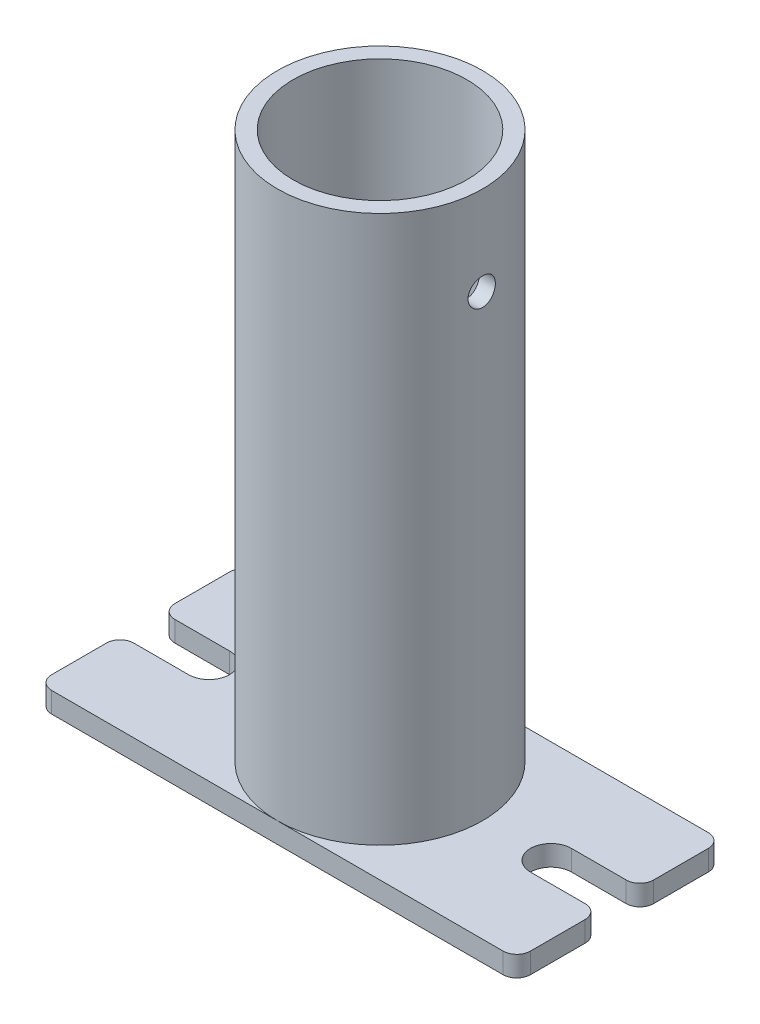
from build123d import *

# Parameters (mm, degrees)
BOSS_EXTRUDE2_DEPTH = 3
SKETCH3_R           = 15
BOSS_EXTRUDE3_DEPTH = 5
SKETCH4_R           = 15
SKETCH4_R_2         = 12.7
BOSS_EXTRUDE5_DEPTH = 75
SKETCH5_R           = 2
CUT_EXTRUDE1_DEPTH  = 40


with BuildPart() as part:
    # Sketch1 → Boss-Extrude2 (new body)
    with BuildSketch(Plane(origin=(0, 0, 0), x_dir=(1, 0, 0), z_dir=(0, 1, 0))):
        with BuildLine():
            Line((2, 0), (68, 0))
            ThreePointArc((68, 0), (69.414213562, 0.585786438), (70, 2))
            Line((70, 2), (70, 10))
            ThreePointArc((70, 10), (69.414213562, 11.414213562), (68, 12))
            Line((68, 12), (60, 12))
            ThreePointArc((60, 12), (57, 15), (60, 18))
            Line((60, 18), (68, 18))
            ThreePointArc((68, 18), (69.414213562, 18.585786438), (70, 20))
            Line((70, 20), (70, 28))
            ThreePointArc((70, 28), (69.414213562, 29.414213562), (68, 30))
            Line((68, 30), (2, 30))
            ThreePointArc((2, 30), (0.585786438, 29.414213562), (0, 28))
            Line((0, 28), (0, 20))
            ThreePointArc((0, 20), (0.585786438, 18.585786438), (2, 18))
            Line((2, 18), (10, 18))
            ThreePointArc((10, 18), (13, 15), (10, 12))
            Line((10, 12), (2, 12))
            ThreePointArc((2, 12), (0.585786438, 11.414213562), (0, 10))
            Line((0, 10), (0, 2))
            ThreePointArc((0, 2), (0.585786438, 0.585786438), (2, 0))
        make_face()
    extrude(amount=BOSS_EXTRUDE2_DEPTH)

    # Sketch3 → Boss-Extrude3 (add)
    with BuildSketch(Plane(origin=(0, 3, 0), x_dir=(1, 0, 0), z_dir=(0, 1, 0))):
        with Locations(Location((35, 15, 0), (0, 0, 270))):
            Circle(SKETCH3_R)
    extrude(amount=BOSS_EXTRUDE3_DEPTH)

    # Sketch4 → Boss-Extrude5 (add)
    with BuildSketch(Plane(origin=(0, 8, 0), x_dir=(1, 0, 0), z_dir=(0, 1, 0))):
        with Locations(Location((35, 15, 0), (0, 0, 270))):
            Circle(SKETCH4_R)
        with Locations(Location((35, 15, 0), (0, 0, 270))):
            Circle(SKETCH4_R_2, mode=Mode.SUBTRACT)
    extrude(amount=BOSS_EXTRUDE5_DEPTH)

    # Sketch5 → Cut-Extrude1 (cut)
    with BuildSketch(Plane(origin=(70, 0, 0), x_dir=(0, 0, -1), z_dir=(1, 0, 0))):
        with Locations((15, 70)):
            Circle(SKETCH5_R)
    extrude(amount=-CUT_EXTRUDE1_DEPTH, mode=Mode.SUBTRACT)


solid = part.part
